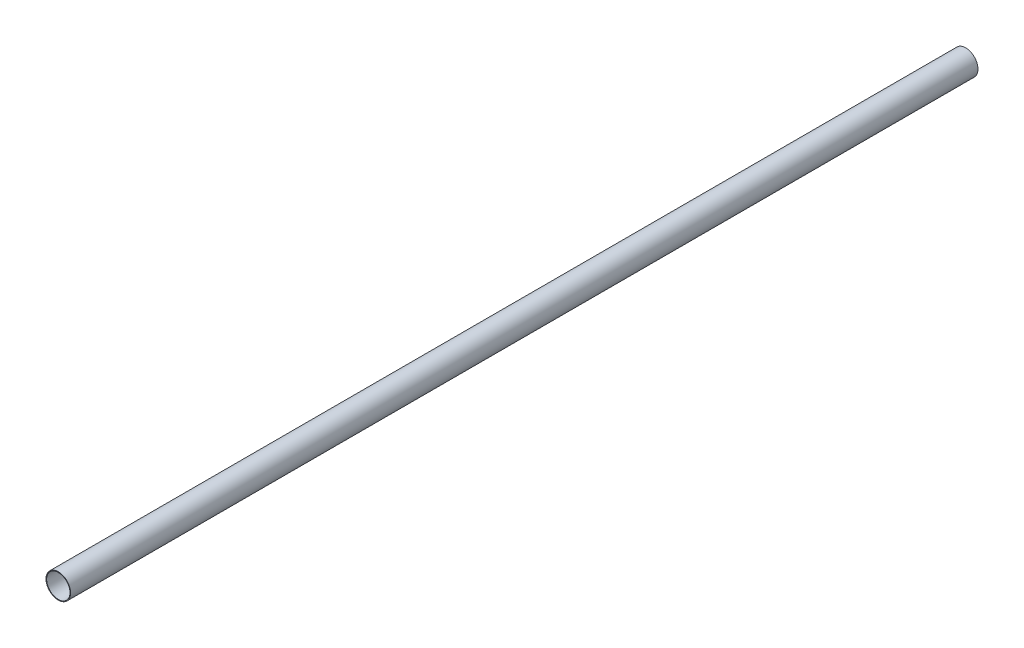
from build123d import *

# Parameters (mm, degrees)
SKETCH1_R           = 11.25
SKETCH1_R_2         = 10.65
BOSS_EXTRUDE1_DEPTH = 829


with BuildPart() as part:
    # Sketch1 → Boss-Extrude1 (new body)
    with BuildSketch(Plane.XY):
        Circle(SKETCH1_R)
        Circle(SKETCH1_R_2, mode=Mode.SUBTRACT)
    extrude(amount=BOSS_EXTRUDE1_DEPTH)


solid = part.part
